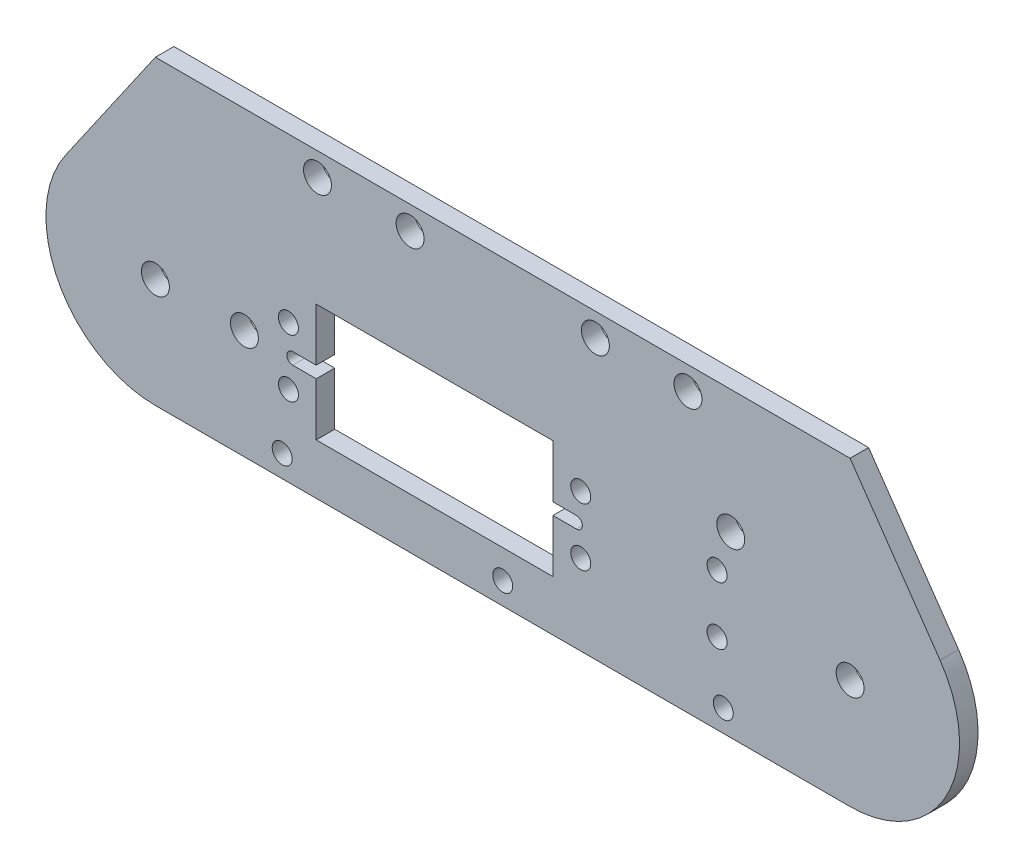
from build123d import *

# Parameters (mm, degrees)
SKETCH1_R           = 2.413
BOSS_EXTRUDE1_DEPTH = 3.2004
SKETCH2_R           = 2.413
CUT_EXTRUDE1_DEPTH  = 3.2004
SKETCH5_R           = 1.7272
SKETCH5_W           = 40.894
SKETCH5_H           = 20.32
CUT_EXTRUDE3_DEPTH  = 149.410997158
SKETCH6_R           = 1.7272
CUT_EXTRUDE4_DEPTH  = 3.2004
SKETCH7_R           = 2.413
CUT_EXTRUDE5_DEPTH  = 3.2004
SKETCH8_R           = 1.7272
CUT_EXTRUDE6_DEPTH  = 3.2004


with BuildPart() as part:
    # Sketch1 → Boss-Extrude1 (new body)
    with BuildSketch(Plane.XY):
        with BuildLine():
            Line((120.015, 52.11572), (0, 52.11572))
            Line((0, 52.11572), (-15.54366081, 29.673353196))
            ThreePointArc((-15.54366081, 29.673353196), (-16.74897968, 10.134216365), (0, 0))
            Line((0, 0), (120.015, 0))
            ThreePointArc((120.015, 0), (136.76397968, 10.134216365), (135.55866081, 29.673353196))
            Line((135.55866081, 29.673353196), (120.015, 52.11572))
        make_face()
        with Locations((120.015, 18.90776)):
            Circle(SKETCH1_R, mode=Mode.SUBTRACT)
        with Locations((0, 18.90776)):
            Circle(SKETCH1_R, mode=Mode.SUBTRACT)
        with Locations((15.37290121, 18.90776)):
            Circle(SKETCH1_R, mode=Mode.SUBTRACT)
    extrude(amount=BOSS_EXTRUDE1_DEPTH)

    # Sketch2 → Cut-Extrude1 (cut)
    with BuildSketch(Plane(origin=(0, 0, 0), x_dir=(-1, 0, 0), z_dir=(0, 0, -1))):
        with Locations((-92.0115, 48.11522)):
            Circle(SKETCH2_R)
        with Locations((-76.0095, 48.11522)):
            Circle(SKETCH2_R)
        with Locations((-44.0055, 48.11522)):
            Circle(SKETCH2_R)
        with Locations((-28.0035, 48.11522)):
            Circle(SKETCH2_R)
    extrude(amount=-CUT_EXTRUDE1_DEPTH, mode=Mode.SUBTRACT)

    # Sketch5 → Cut-Extrude3 (cut, through all)
    with BuildSketch(Plane(origin=(0, 0, 0), x_dir=(-1, 0, 0), z_dir=(0, 0, -1))):
        with Locations((-73.48130308, 23.90776)):
            Circle(SKETCH5_R)
        with Locations((-22.98130308, 13.90776)):
            Circle(SKETCH5_R)
        with Locations((-22.98130308, 23.90776)):
            Circle(SKETCH5_R)
        with Locations((-73.48130308, 13.90776)):
            Circle(SKETCH5_R)
        with Locations((-48.23130308, 18.90776)):
            Rectangle(SKETCH5_W, SKETCH5_H)
    extrude(amount=-CUT_EXTRUDE3_DEPTH, mode=Mode.SUBTRACT)

    # Sketch6 → Cut-Extrude4 (cut)
    with BuildSketch(Plane.XY.offset(3.2004)):
        with Locations((97.03369692, 23.90776)):
            Circle(SKETCH6_R)
        with Locations((97.03369692, 13.90776)):
            Circle(SKETCH6_R)
        with BuildLine():
            Line((23.72030308, 19.92376), (27.78430308, 19.92376))
            Line((27.78430308, 19.92376), (27.78430308, 17.89176))
            Line((27.78430308, 17.89176), (23.72030308, 17.89176))
            ThreePointArc((23.72030308, 17.89176), (22.70430308, 18.90776), (23.72030308, 19.92376))
        make_face()
        with BuildLine():
            Line((68.67830308, 19.92376), (72.74230308, 19.92376))
            ThreePointArc((72.74230308, 19.92376), (73.75830308, 18.90776), (72.74230308, 17.89176))
            Line((72.74230308, 17.89176), (68.67830308, 17.89176))
            Line((68.67830308, 17.89176), (68.67830308, 19.92376))
        make_face()
    extrude(amount=-CUT_EXTRUDE4_DEPTH, mode=Mode.SUBTRACT)

    # Sketch7 → Cut-Extrude5 (cut)
    with BuildSketch(Plane(origin=(0, 0, 0), x_dir=(-1, 0, 0), z_dir=(0, 0, -1))):
        with Locations((-99.400822531, 30.809360911)):
            Circle(SKETCH7_R)
    extrude(amount=-CUT_EXTRUDE5_DEPTH, mode=Mode.SUBTRACT)

    # Sketch8 → Cut-Extrude6 (cut)
    with BuildSketch(Plane.XY.offset(3.2004)):
        with Locations((21.9075, 3.81)):
            Circle(SKETCH8_R)
        with Locations((60.0075, 3.81)):
            Circle(SKETCH8_R)
        with Locations((98.1075, 3.81)):
            Circle(SKETCH8_R)
    extrude(amount=-CUT_EXTRUDE6_DEPTH, mode=Mode.SUBTRACT)


solid = part.part
